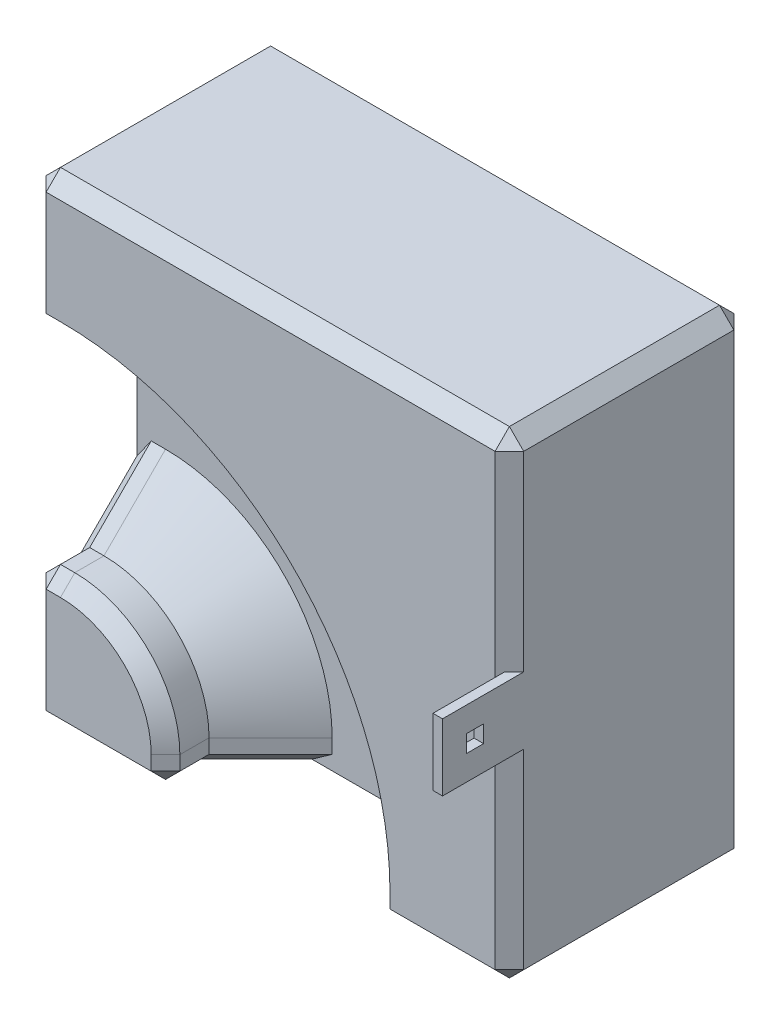
from build123d import *

# Parameters (mm, degrees)
SKETCH1_W                = 50
SKETCH1_H                = 50
BOSS_EXTRUDE1_DEPTH      = 25
CHAMFER1_SIZE            = 1.5
BOSS_EXTRUDE2_DEPTH      = 7
BOSS_EXTRUDE2_DEPTH_BACK = 10
SKETCH5_W                = 1
SKETCH5_H                = 7
SKETCH6_W                = 1.8
SKETCH6_H                = 1.8
CUT_EXTRUDE1_DEPTH       = 7


with BuildPart() as part:
    # Sketch1 → Boss-Extrude1 (new body)
    with BuildSketch(Plane.XY):
        with Locations((25, 25)):
            Rectangle(SKETCH1_W, SKETCH1_H)
    extrude(amount=BOSS_EXTRUDE1_DEPTH)

    # Cut-Sweep1: sweep along a path in Sketch4
    with BuildLine(Plane.XY.offset(25)) as cut_sweep1_path:
        Line((25, 0), (25, 3))
        ThreePointArc((25, 3), (18.556349186, 18.556349186), (3, 25))
        Line((3, 25), (0, 25))
    # Sketch3 → Cut-Sweep1 (sweep, cut)
    with BuildSketch(Plane.XZ):
        Polygon((36, 29.556349186), (29.556349186, 36), (20.443650814, 36), (14, 29.556349186), (14, 20.443650814), (20.443650814, 14), (29.556349186, 14), (36, 20.443650814), align=None)
    sweep(path=cut_sweep1_path.line, mode=Mode.SUBTRACT)

    # Chamfer1
    chamfer1_edges = [part.edges().sort_by_distance(p)[0] for p in [
        (50, 25, 25),
        (25, 50, 25),
        (0, 7, 25),
        (43, 0, 25),
        (14, 1.5, 25),
        (10.778174593, 10.778174593, 25),
        (1.5, 14, 25),
        (36, 1.5, 25),
        (26.334523779, 26.334523779, 25),
        (1.5, 36, 25),
        (0, 14, 22.721825407),
        (0, 36, 22.721825407),
        (36, 0, 22.721825407),
        (14, 0, 22.721825407),
        (17.221825407, 0, 17.221825407),
        (32.778174593, 0, 17.221825407),
        (0, 32.778174593, 17.221825407),
        (0, 17.221825407, 17.221825407),
        (0, 43, 25),
        (25, 50, 0),
        (50, 25, 0),
        (25, 0, 0),
        (0, 25, 0),
        (7, 0, 25),
        (0, 50, 12.5),
        (50, 50, 12.5),
        (50, 0, 12.5),
        (0, 0, 12.5),
    ]]
    chamfer(chamfer1_edges, length=CHAMFER1_SIZE)

    # Sketch5 → Boss-Extrude2 (add, two sides: drawn at the far end of the back side and taken through both)
    with BuildSketch(Plane.XY.offset(25).offset(-BOSS_EXTRUDE2_DEPTH_BACK)):
        with Locations((49.5, 25)):
            Rectangle(SKETCH5_W, SKETCH5_H)
    extrude(amount=BOSS_EXTRUDE2_DEPTH + BOSS_EXTRUDE2_DEPTH_BACK)

    # Sketch6 → Cut-Extrude1 (cut)
    with BuildSketch(Plane(origin=(50, 0, 0), x_dir=(0, 0, -1), z_dir=(1, 0, 0))):
        with Locations((-28.6, 25)):
            Rectangle(SKETCH6_W, SKETCH6_H)
    extrude(amount=-CUT_EXTRUDE1_DEPTH, mode=Mode.SUBTRACT)


solid = part.part
